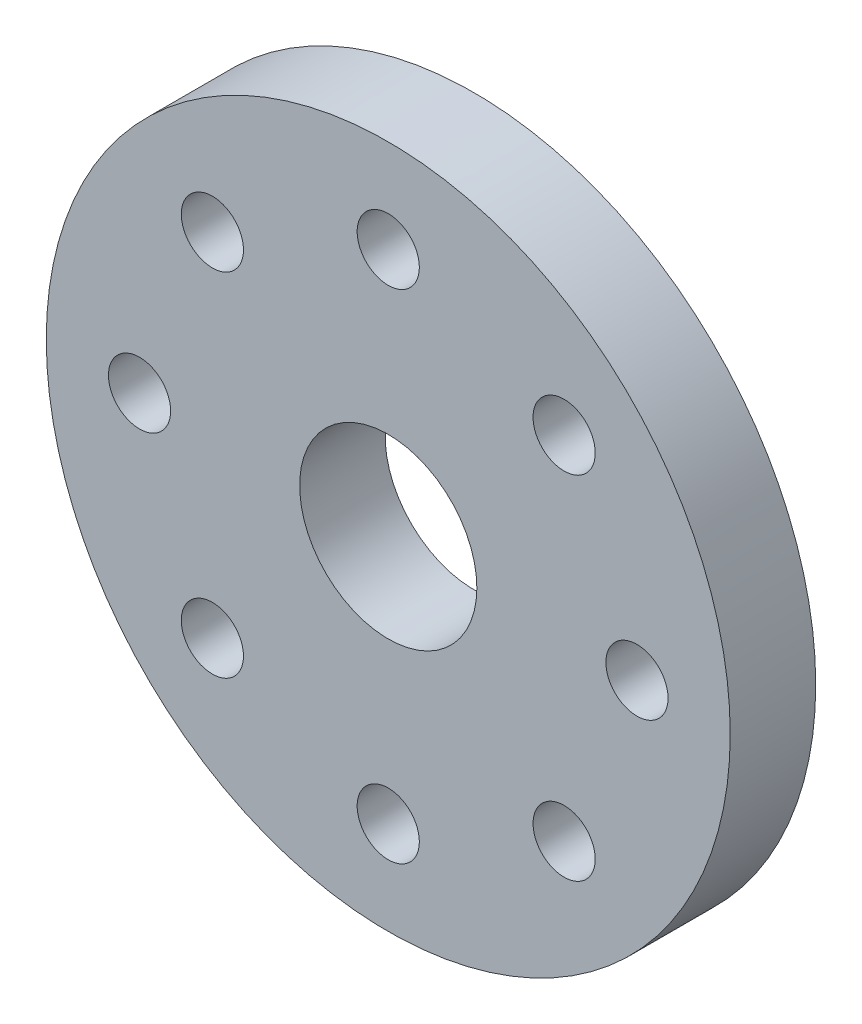
from build123d import *

# Parameters (mm, degrees)
SKETCH1_R           = 11
SKETCH1_R_2         = 2.85
BOSS_EXTRUDE1_DEPTH = 2.75
SKETCH2_R           = 1
CUT_EXTRUDE1_DEPTH  = 16.797547278


with BuildPart() as part:
    # Sketch1 → Boss-Extrude1 (new body)
    with BuildSketch(Plane.XY):
        Circle(SKETCH1_R)
        Circle(SKETCH1_R_2, mode=Mode.SUBTRACT)
    extrude(amount=BOSS_EXTRUDE1_DEPTH)

    # Sketch2 → Cut-Extrude1 (cut, through all)
    with BuildSketch(Plane.XY.offset(2.75)):
        with Locations((0, 8)):
            Circle(SKETCH2_R)
        with Locations((5.656854249, 5.656854249)):
            Circle(SKETCH2_R)
        with Locations((8, 0)):
            Circle(SKETCH2_R)
        with Locations((5.656854249, -5.656854249)):
            Circle(SKETCH2_R)
        with Locations((0, -8)):
            Circle(SKETCH2_R)
        with Locations((-5.656854249, -5.656854249)):
            Circle(SKETCH2_R)
        with Locations((-8, 0)):
            Circle(SKETCH2_R)
        with Locations((-5.656854249, 5.656854249)):
            Circle(SKETCH2_R)
    extrude(amount=-CUT_EXTRUDE1_DEPTH, mode=Mode.SUBTRACT)


solid = part.part
